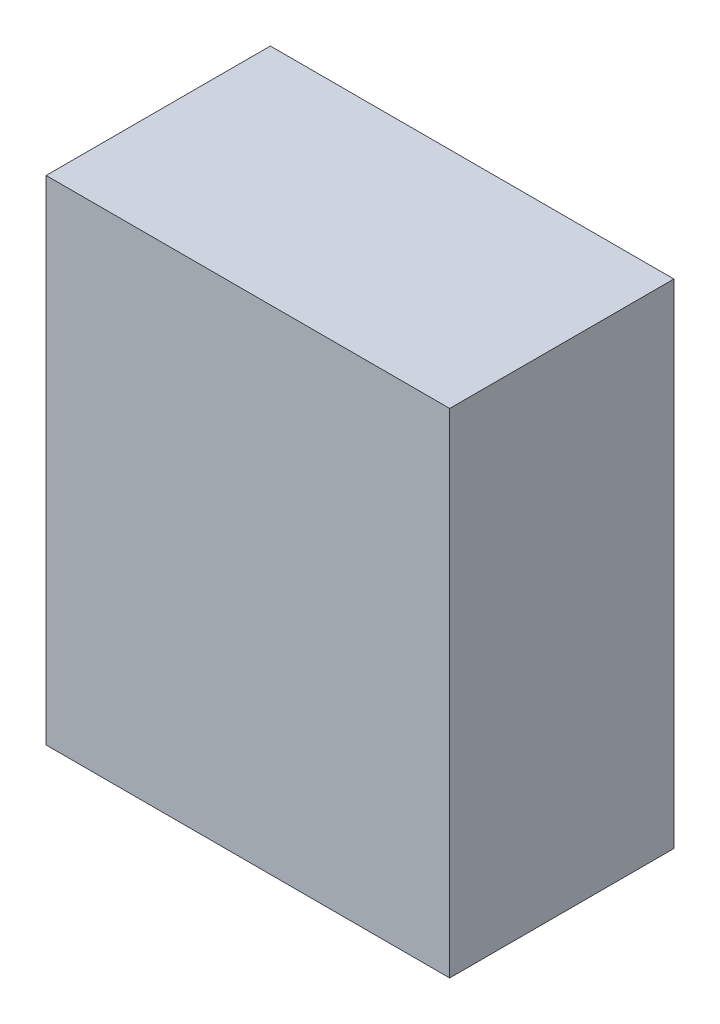
from build123d import *

# Parameters (mm, degrees)
SKETCH1_W           = 36
SKETCH1_H           = 44
BOSS_EXTRUDE1_DEPTH = 20


with BuildPart() as part:
    # Sketch1 → Boss-Extrude1 (new body)
    with BuildSketch(Plane.XY):
        Rectangle(SKETCH1_W, SKETCH1_H)
    extrude(amount=BOSS_EXTRUDE1_DEPTH)


solid = part.part
